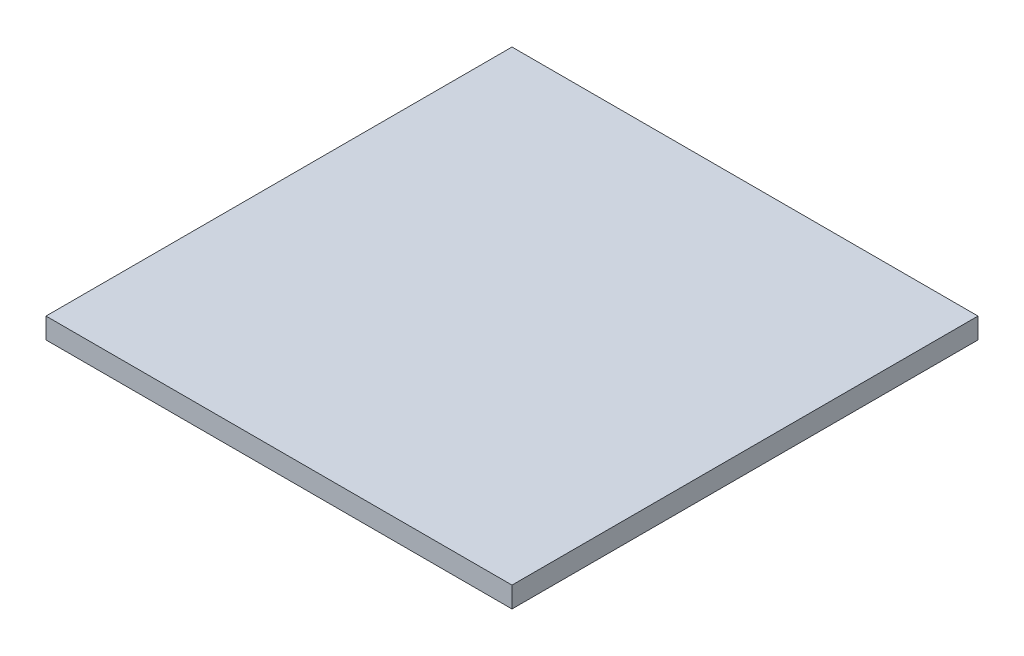
from build123d import *

# Parameters (mm, degrees)
ESQUISSE1_W        = 45
ESQUISSE1_H        = 45
BOSS_EXTRU_1_DEPTH = 2


with BuildPart() as part:
    # Esquisse1 → Boss.-Extru.1 (new body)
    with BuildSketch(Plane(origin=(0, 0, 0), x_dir=(1, 0, 0), z_dir=(0, 1, 0))):
        with Locations((22.5, 22.5)):
            Rectangle(ESQUISSE1_W, ESQUISSE1_H)
    extrude(amount=BOSS_EXTRU_1_DEPTH)


solid = part.part
